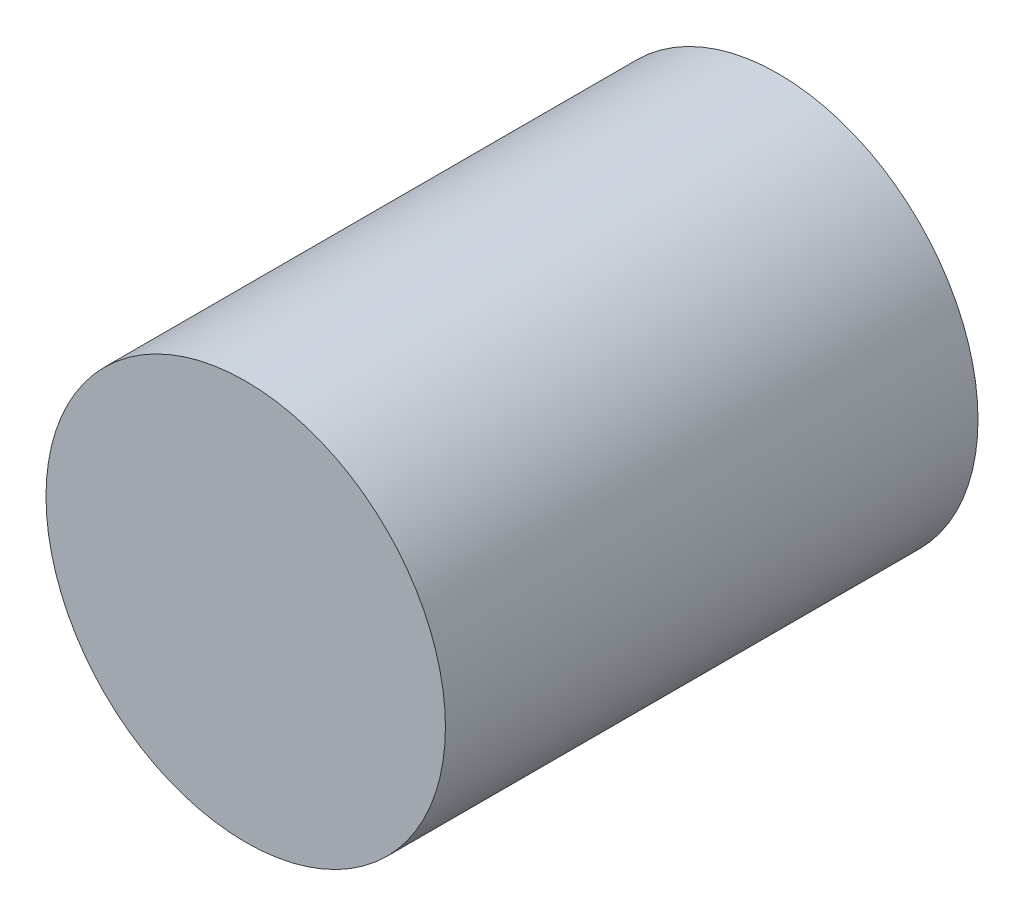
from build123d import *

# Parameters (mm, degrees)
SKETCH_1_R      = 30
EXTRUDE_1_DEPTH = 80


with BuildPart() as part:
    # 草图1 → 凸台-拉伸1 (new body)
    with BuildSketch(Plane.XY):
        Circle(SKETCH_1_R)
    extrude(amount=EXTRUDE_1_DEPTH)


solid = part.part
